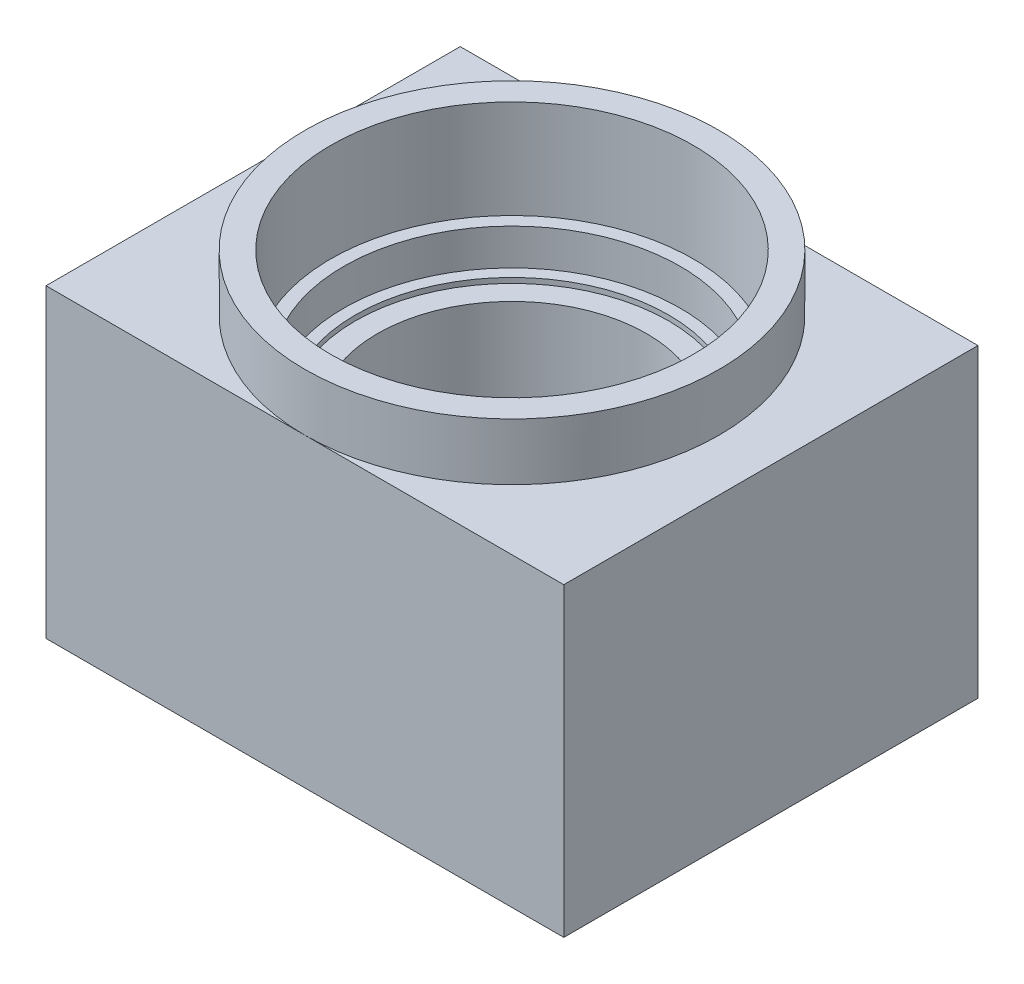
from build123d import *

# Parameters (mm, degrees)
SKETCH1_W           = 100
SKETCH1_H           = 80
SKETCH1_R           = 26
BOSS_EXTRUDE1_DEPTH = 70
SKETCH2_R           = 32.5
CUT_EXTRUDE1_DEPTH  = 27
BOSS_EXTRUDE2_START = 1
SKETCH4_R           = 32.5
SKETCH4_R_2         = 30.25
BOSS_EXTRUDE2_DEPTH = 1
SKETCH5_R           = 35
CUT_EXTRUDE2_DEPTH  = 19
CUT_EXTRUDE3_START  = -8
SKETCH6_R           = 32.5
CUT_EXTRUDE3_DEPTH  = 8
CUT_EXTRUDE4_START  = -1
SKETCH7_R           = 30.25
CUT_EXTRUDE4_DEPTH  = 1
CUT_EXTRUDE5_DEPTH  = 11


with BuildPart() as part:
    # Sketch1 → Boss-Extrude1 (new body)
    with BuildSketch(Plane(origin=(0, 0, 0), x_dir=(1, 0, 0), z_dir=(0, 1, 0))):
        Rectangle(SKETCH1_W, SKETCH1_H)
        with Locations(Location((0, 0, 0), (0, 0, 270))):
            Circle(SKETCH1_R, mode=Mode.SUBTRACT)
    extrude(amount=BOSS_EXTRUDE1_DEPTH)

    # Sketch2 → Cut-Extrude1 (cut)
    with BuildSketch(Plane(origin=(0, 70, 0), x_dir=(1, 0, 0), z_dir=(0, 1, 0))):
        with Locations(Location((0, 0, 0), (0, 0, 270))):
            Circle(SKETCH2_R)
    extrude(amount=-CUT_EXTRUDE1_DEPTH, mode=Mode.SUBTRACT)

    # Sketch4 → Boss-Extrude2 (add)
    with BuildSketch(Plane(origin=(0, 43, 0), x_dir=(1, 0, 0), z_dir=(0, 1, 0)).offset(BOSS_EXTRUDE2_START)):
        with Locations(Location((0, 0, 0), (0, 0, 270))):
            Circle(SKETCH4_R)
        with Locations(Location((0, 0, 0), (0, 0, 270))):
            Circle(SKETCH4_R_2, mode=Mode.SUBTRACT)
    extrude(amount=-BOSS_EXTRUDE2_DEPTH)

    # Sketch5 → Cut-Extrude2 (cut)
    with BuildSketch(Plane(origin=(0, 70, 0), x_dir=(1, 0, 0), z_dir=(0, 1, 0))):
        with Locations(Location((0, 0, 0), (0, 0, 270))):
            Circle(SKETCH5_R)
    extrude(amount=-CUT_EXTRUDE2_DEPTH, mode=Mode.SUBTRACT)

    # Sketch6 → Cut-Extrude3 (cut)
    with BuildSketch(Plane.XZ.offset(CUT_EXTRUDE3_START)):
        with Locations(Location((0, 0, 0), (0, 0, 90))):
            Circle(SKETCH6_R)
    extrude(amount=CUT_EXTRUDE3_DEPTH, mode=Mode.SUBTRACT)

    # Sketch7 → Cut-Extrude4 (cut)
    with BuildSketch(Plane.XZ.offset(-8).offset(CUT_EXTRUDE4_START)):
        with Locations(Location((0, 0, 0), (0, 0, 90))):
            Circle(SKETCH7_R)
    extrude(amount=CUT_EXTRUDE4_DEPTH, mode=Mode.SUBTRACT)

    # Sketch8 → Cut-Extrude5 (cut)
    with BuildSketch(Plane(origin=(0, 70, 0), x_dir=(1, 0, 0), z_dir=(0, 1, 0))):
        with BuildLine():
            Line((50, 40), (0, 40))
            ThreePointArc((0, 40), (28.284271247, 28.284271247), (40, 0))
            ThreePointArc((40, 0), (28.284271247, -28.284271247), (0, -40))
            Line((0, -40), (50, -40))
            Line((50, -40), (50, 40))
        make_face()
        with BuildLine():
            Line((0, 40), (-50, 40))
            Line((-50, 40), (-50, -40))
            Line((-50, -40), (0, -40))
            ThreePointArc((0, -40), (-40, 0), (0, 40))
        make_face()
    extrude(amount=-CUT_EXTRUDE5_DEPTH, mode=Mode.SUBTRACT)


solid = part.part
